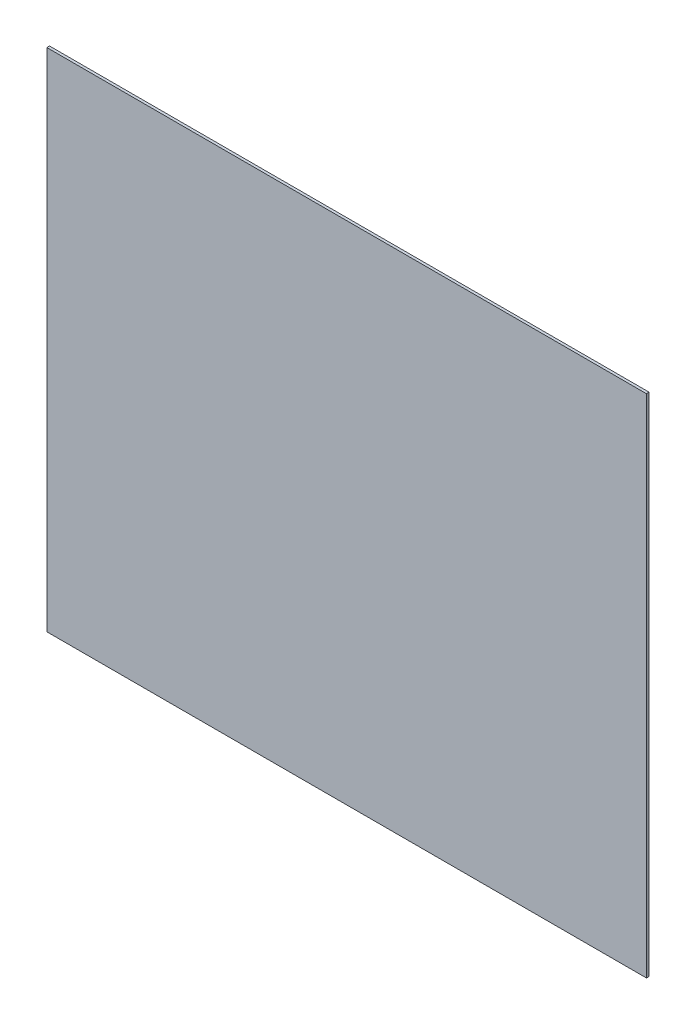
from build123d import *

# Parameters (mm, degrees)
SKETCH1_W           = 675.4
SKETCH1_H           = 570
BOSS_EXTRUDE1_DEPTH = 3


with BuildPart() as part:
    # Sketch1 → Boss-Extrude1 (new body)
    with BuildSketch(Plane.XY):
        Rectangle(SKETCH1_W, SKETCH1_H)
    extrude(amount=BOSS_EXTRUDE1_DEPTH)


solid = part.part
